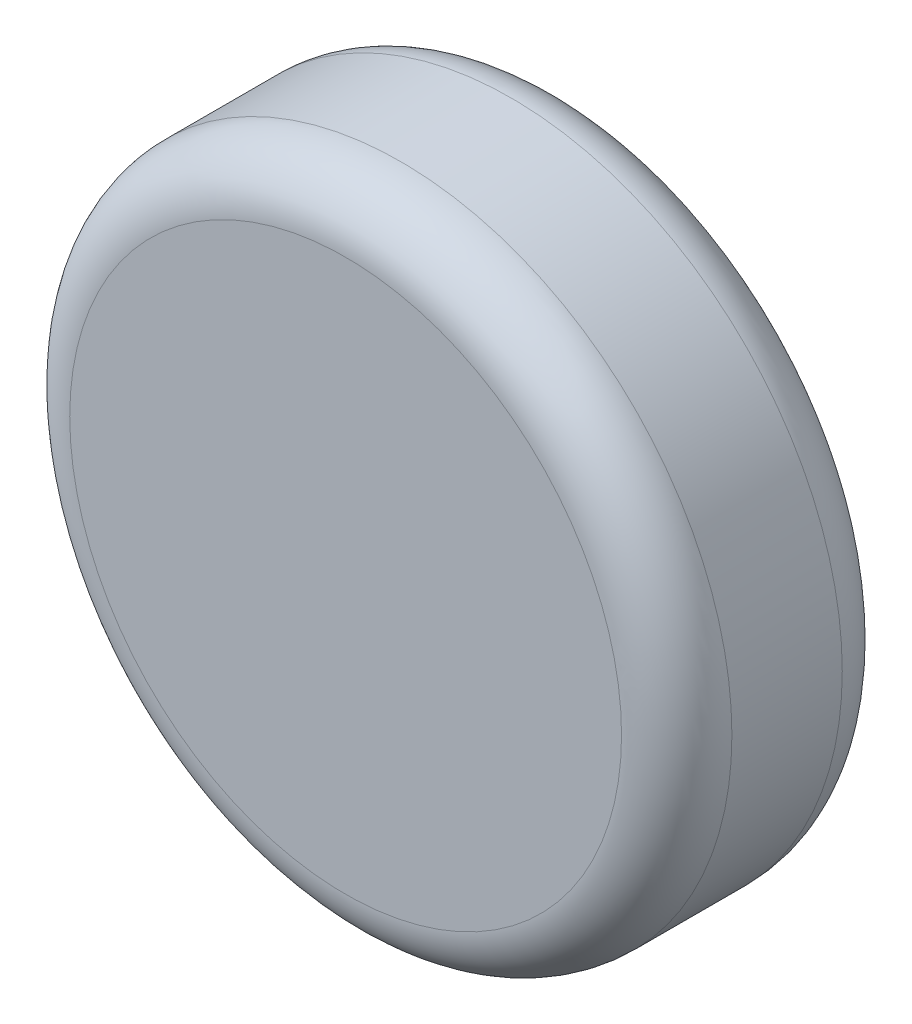
from build123d import *

# Parameters (mm, degrees)
SKETCH1_R           = 76.2
BOSS_EXTRUDE1_DEPTH = 50.8
FILLET1_R           = 12.7


with BuildPart() as part:
    # Sketch1 → Boss-Extrude1 (new body)
    with BuildSketch(Plane.XY):
        Circle(SKETCH1_R)
    extrude(amount=BOSS_EXTRUDE1_DEPTH)

    # Fillet1
    fillet1_edges = [part.edges().sort_by_distance(p)[0] for p in [
        (-76.2, 0, 0),
        (-76.2, 0, 50.8),
    ]]
    fillet(fillet1_edges, radius=FILLET1_R)


solid = part.part
